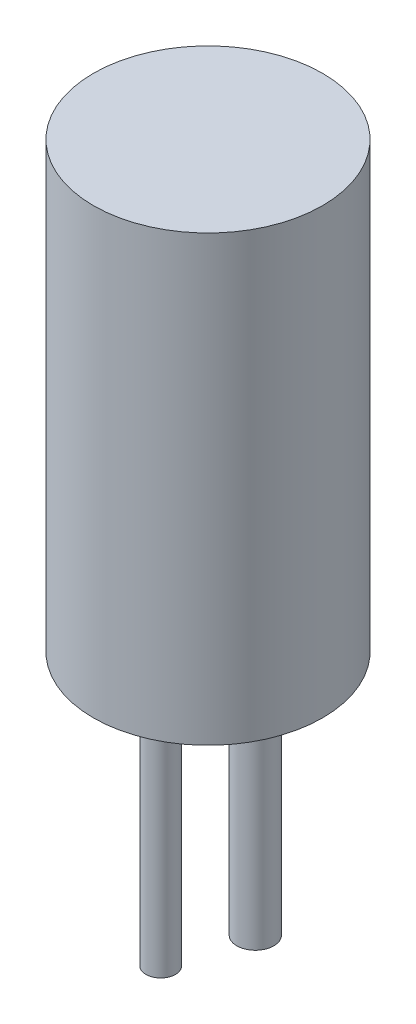
from build123d import *

# Parameters (mm, degrees)
SKETCH_1_R      = 3.1
EXTRUDE_1_DEPTH = 12
SKETCH_2_R      = 0.4
EXTRUDE_2_DEPTH = 8
SKETCH_3_R      = 0.5
EXTRUDE_3_DEPTH = 6


with BuildPart() as part:
    # 草图1 → 拉伸1 (new body)
    with BuildSketch(Plane(origin=(0, 0, 0), x_dir=(1, 0, 0), z_dir=(0, 1, 0))):
        with Locations(Location((0, 0, 0), (0, 0, 270))):
            Circle(SKETCH_1_R)
    extrude(amount=EXTRUDE_1_DEPTH)

    # 草图2 → 拉伸2 (add)
    with BuildSketch(Plane.XZ):
        with Locations(Location((-1.28, 0, 0), (0, 0, 90))):
            Circle(SKETCH_2_R)
    extrude(amount=EXTRUDE_2_DEPTH)

    # 草图3 → 拉伸3 (add)
    with BuildSketch(Plane.XZ):
        with Locations(Location((1.28, 0, 0), (0, 0, 90))):
            Circle(SKETCH_3_R)
    extrude(amount=EXTRUDE_3_DEPTH)


solid = part.part
